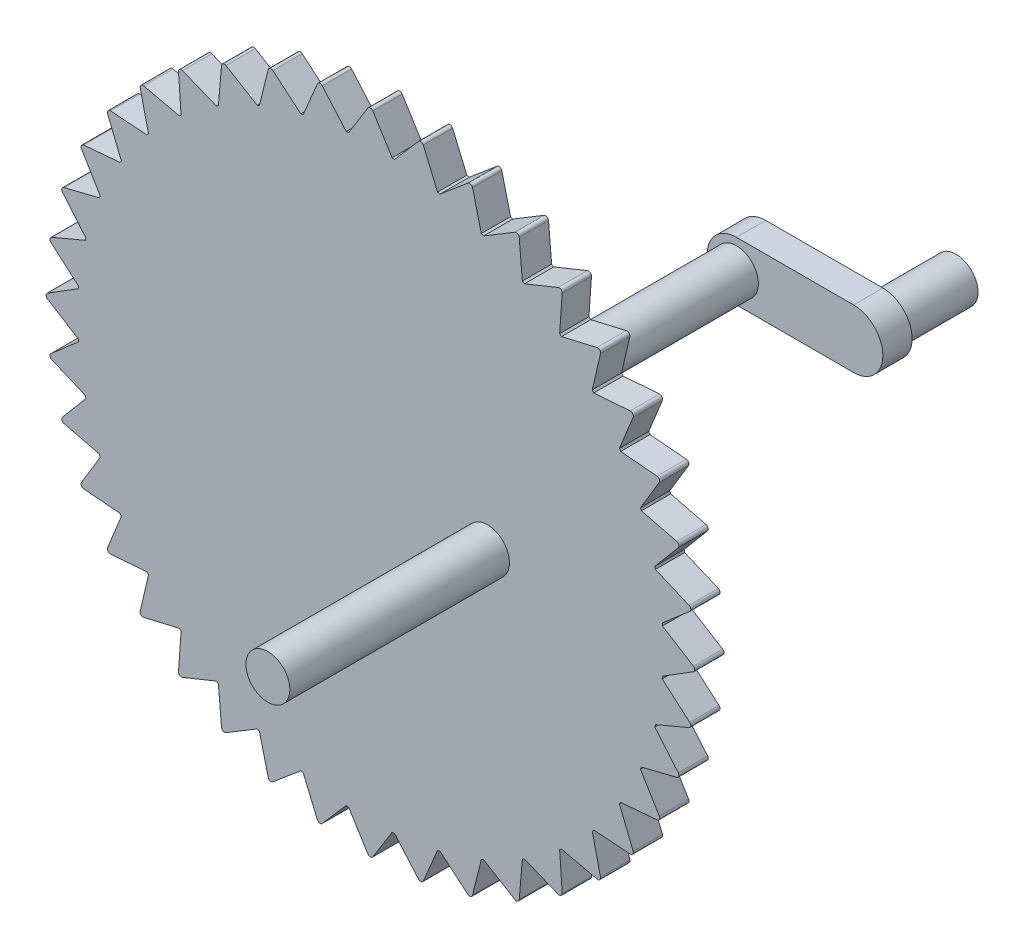
from build123d import *

# Parameters (mm, degrees)
SKETCH1_R           = 20
BOSS_EXTRUDE1_DEPTH = 2
BOSS_EXTRUDE2_START = -2
BOSS_EXTRUDE2_DEPTH = 2
CIRPATTERN1_COUNT   = 40
SKETCH3_R           = 1.5
BOSS_EXTRUDE3_DEPTH = 25
SKETCH4_R           = 1.5
BOSS_EXTRUDE4_DEPTH = 15
BOSS_EXTRUDE5_DEPTH = 2
BOSS_EXTRUDE6_START = 5
SKETCH7_R           = 1.5
BOSS_EXTRUDE6_DEPTH = 5
CUT_EXTRUDE1_START  = -15
SKETCH8_R           = 1.5
CUT_EXTRUDE1_DEPTH  = 15


with BuildPart() as part:
    # Sketch1 → Boss-Extrude1 (new body)
    with BuildSketch(Plane.XY):
        Circle(SKETCH1_R)
    extrude(amount=BOSS_EXTRUDE1_DEPTH)

    # Sketch2 → Boss-Extrude2 (add)
    with BuildSketch(Plane.XY.offset(2).offset(BOSS_EXTRUDE2_START)):
        with BuildLine():
            ThreePointArc((0.169734412, 22.057312797), (0, 22.151528917), (-0.169734412, 22.057312797))
            Line((-0.169734412, 22.057312797), (-1.486388228, 19.94468977))
            ThreePointArc((-1.486388228, 19.94468977), (0, 20), (1.486388228, 19.94468977))
            Line((1.486388228, 19.94468977), (0.169734412, 22.057312797))
        make_face()
    boss_extrude2 = extrude(amount=BOSS_EXTRUDE2_DEPTH)

    # CirPattern1: Boss-Extrude2 ×40 about axis
    cirpattern1_axis = Axis((0, 0, 0), (0, 0, 1))
    for i in range(1, CIRPATTERN1_COUNT):
        add(boss_extrude2.rotate(cirpattern1_axis, i * 360 / CIRPATTERN1_COUNT))

    # Sketch3 → Boss-Extrude3 (add)
    with BuildSketch(Plane.XY.offset(2)):
        Circle(SKETCH3_R)
    extrude(amount=-BOSS_EXTRUDE3_DEPTH)

    # Sketch4 → Boss-Extrude4 (add)
    with BuildSketch(Plane.XY.offset(2)):
        with Locations((-8, 0)):
            Circle(SKETCH4_R)
        with Locations(Location((8, 0, 0), (0, 0, 180))):
            Circle(SKETCH4_R)
    extrude(amount=BOSS_EXTRUDE4_DEPTH)

    # Sketch6 → Boss-Extrude5 (add)
    with BuildSketch(Plane(origin=(0, 0, -23), x_dir=(-1, 0, 0), z_dir=(0, 0, -1))):
        with BuildLine():
            Line((0, -2), (-8, -2))
            ThreePointArc((-8, -2), (-10, 0), (-8, 2))
            Line((-8, 2), (0, 2))
            ThreePointArc((0, 2), (2, 0), (0, -2))
        make_face()
    extrude(amount=BOSS_EXTRUDE5_DEPTH)

    # Sketch7 → Boss-Extrude6 (add)
    with BuildSketch(Plane(origin=(0, 0, -25), x_dir=(-1, 0, 0), z_dir=(0, 0, -1)).offset(BOSS_EXTRUDE6_START)):
        with Locations((-8, 0)):
            Circle(SKETCH7_R)
    extrude(amount=-BOSS_EXTRUDE6_DEPTH)

    # Sketch8 → Cut-Extrude1 (cut)
    with BuildSketch(Plane.XY.offset(17).offset(CUT_EXTRUDE1_START)):
        with Locations((-8, 0)):
            Circle(SKETCH8_R)
    extrude(amount=CUT_EXTRUDE1_DEPTH, mode=Mode.SUBTRACT)


solid = part.part
